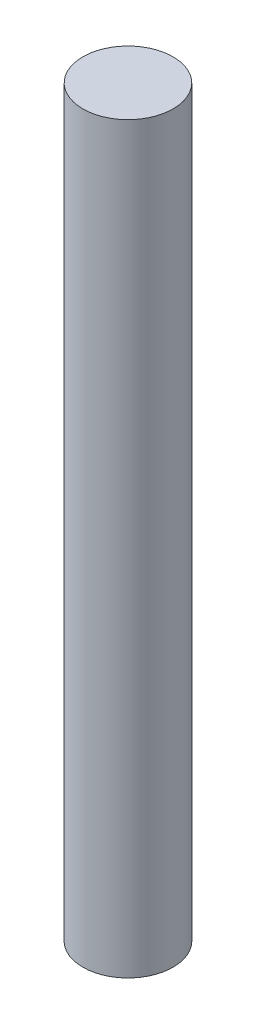
from build123d import *

# Parameters (mm, degrees)
SKETCH2_R           = 0.85
BOSS_EXTRUDE1_DEPTH = 14


with BuildPart() as part:
    # Sketch2 → Boss-Extrude1 (new body)
    with BuildSketch(Plane(origin=(0, 0, 0), x_dir=(1, 0, 0), z_dir=(0, 1, 0))):
        with Locations(Location((0, 0, 0), (0, 0, 270))):
            Circle(SKETCH2_R)
    extrude(amount=BOSS_EXTRUDE1_DEPTH)


solid = part.part
